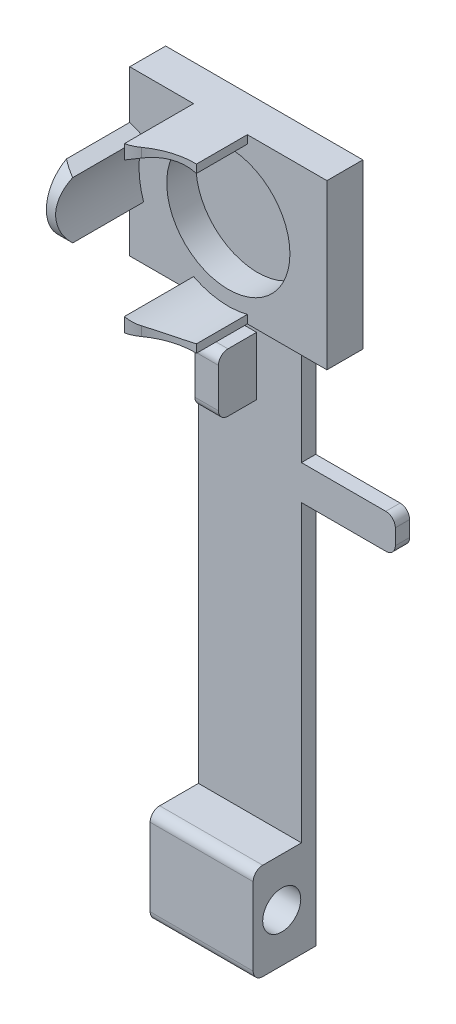
from build123d import *

# Parameters (mm, degrees)
EXTRUDE_4_DEPTH          = 3.01
SKETCH_3_W               = 41.43
SKETCH_3_H               = 34.43
EXTRUDE_5_DEPTH          = 4.54
SKETCH_4_R               = 12.94
CUT_EXTRUDE_1_DEPTH      = 6.14
EXTRUDE_7_DEPTH          = 4.94
EXTRUDE_9_DEPTH          = 21.64
SKETCH_8_R               = 4
CUT_EXTRUDE_2_DEPTH      = 138.779016272
EXTRUDE_10_DEPTH         = 14.55
CUT_EXTRUDE_7_REACH      = 154.706
CUT_EXTRUDE_7_END_RADIUS = 16
EXTRUDE_11_DEPTH         = 17.51
CUT_EXTRUDE_8_REACH      = 144.669
CUT_EXTRUDE_8_END_RADIUS = 18.768238988


with BuildPart() as part:
    # 草图1 → 凸台-拉伸4 (new body)
    with BuildSketch(Plane.XY):
        with BuildLine():
            Line((10.82, -17.215), (10.82, -41.305))
            Line((10.82, -41.305), (28.54, -41.305))
            ThreePointArc((28.54, -41.305), (29.954213562, -41.890786438), (30.54, -43.305))
            Line((30.54, -43.305), (30.54, -46.575))
            ThreePointArc((30.54, -46.575), (29.954213562, -47.989213562), (28.54, -48.575))
            Line((28.54, -48.575), (10.82, -48.575))
            Line((10.82, -48.575), (10.82, -130.765))
            Line((10.82, -130.765), (-10.82, -130.765))
            Line((-10.82, -130.765), (-10.82, -17.215))
            Line((-10.82, -17.215), (-20.715, -17.215))
            Line((-20.715, -17.215), (-20.715, 17.215))
            Line((-20.715, 17.215), (20.715, 17.215))
            Line((20.715, 17.215), (20.715, -17.215))
            Line((20.715, -17.215), (10.82, -17.215))
        make_face()
    extrude(amount=EXTRUDE_4_DEPTH)

    # 草图3 → 凸台-拉伸5 (add)
    with BuildSketch(Plane.XY.offset(3.01)):
        Rectangle(SKETCH_3_W, SKETCH_3_H)
    extrude(amount=EXTRUDE_5_DEPTH)

    # 草图4 → 切除-拉伸1 (cut)
    with BuildSketch(Plane.XY.offset(7.55)):
        Circle(SKETCH_4_R)
    extrude(amount=-CUT_EXTRUDE_1_DEPTH, mode=Mode.SUBTRACT)

    # 草图6 → 凸台-拉伸7 (add)
    with BuildSketch(Plane.ZY.offset(3.55)):
        with BuildLine():
            Line((3.01, -22.315), (9.02, -22.315))
            ThreePointArc((9.02, -22.315), (10.434213562, -22.900786438), (11.02, -24.315))
            Line((11.02, -24.315), (11.02, -32.585))
            ThreePointArc((11.02, -32.585), (10.434213562, -33.999213562), (9.02, -34.585))
            Line((9.02, -34.585), (3.01, -34.585))
            Line((3.01, -34.585), (3.01, -22.315))
        make_face()
    extrude(amount=-EXTRUDE_7_DEPTH)

    # 草图7 → 凸台-拉伸9 (add)
    with BuildSketch(Plane.ZY.offset(10.82)):
        with BuildLine():
            Line((3.01, -130.765), (11.15, -130.765))
            ThreePointArc((11.15, -130.765), (12.564213562, -130.179213562), (13.15, -128.765))
            Line((13.15, -128.765), (13.15, -112.485))
            ThreePointArc((13.15, -112.485), (12.564213562, -111.070786438), (11.15, -110.485))
            Line((11.15, -110.485), (3.01, -110.485))
            Line((3.01, -110.485), (3.01, -130.765))
        make_face()
    extrude(amount=-EXTRUDE_9_DEPTH)

    # 草图8 → 切除-拉伸2 (cut, through all)
    with BuildSketch(Plane.ZY.offset(10.82)):
        with Locations((7.15, -120.625)):
            Circle(SKETCH_8_R)
    extrude(amount=-CUT_EXTRUDE_2_DEPTH, mode=Mode.SUBTRACT)

    # 草图9 → 凸台-拉伸10 (add)
    with BuildSketch(Plane.XY.offset(7.55)):
        with BuildLine():
            Line((3.994247308, 17.215), (-7.290402008, 17.215))
            Line((-7.290402008, 17.215), (-7.290402008, 14.242543262))
            ThreePointArc((-7.290402008, 14.242543262), (-1.762762206, 15.902599454), (3.994247308, 15.493417584))
            Line((3.994247308, 15.493417584), (3.994247308, 17.215))
        make_face()
    extrude_10 = extrude(amount=EXTRUDE_10_DEPTH)

    # 切除-拉伸7: up to this cylinder (the profile starts outside it)
    cut_extrude_7_end = Plane(origin=(0, 0, 20.532167), z_dir=(0, 0, -1)) * Cylinder(CUT_EXTRUDE_7_END_RADIUS, 342.412, mode=Mode.PRIVATE)
    # 草图10 → 切除-拉伸7 (cut, up to the surface)
    with BuildSketch(Plane(origin=(0, 17.215, 0), x_dir=(1, 0, 0), z_dir=(0, 1, 0)), mode=Mode.PRIVATE) as cut_extrude_7_sk1:
        with BuildLine():
            Line((3.994247308, -21.947856721), (3.994247308, -18.232150221))
            ThreePointArc((3.994247308, -18.232150221), (-0.624975177, -18.880311606), (-4.799480887, -20.961376627))
            ThreePointArc((-4.799480887, -20.961376627), (-5.989188818, -21.652656126), (-7.290402008, -22.1))
            Line((-7.290402008, -22.1), (3.994247308, -22.1))
            Line((3.994247308, -22.1), (3.994247308, -21.947856721))
        make_face()
    cut_extrude_7_tool1 = extrude(cut_extrude_7_sk1.sketch, amount=-CUT_EXTRUDE_7_REACH, mode=Mode.PRIVATE) - cut_extrude_7_end
    cut_extrude_7 = cut_extrude_7_tool1.solids().sort_by_distance((-0.002076, 17.215, 20.532167))[0]
    add(cut_extrude_7, mode=Mode.SUBTRACT)

    # 镜向1: 凸台-拉伸10, 切除-拉伸7 across plane
    add(extrude_10.mirror(Plane(origin=(0, 0, 0), x_dir=(0, 0, 1), z_dir=(0, -1, 0))))
    add(cut_extrude_7.mirror(Plane(origin=(0, 0, 0), x_dir=(0, 0, 1), z_dir=(0, -1, 0))), mode=Mode.SUBTRACT)

    # 草图12 → 凸台-拉伸11 (add)
    with BuildSketch(Plane.XY.offset(7.55)):
        with BuildLine():
            Line((-17.802400725, 5.943174502), (-20.715, 7.09508926))
            Line((-20.715, 7.09508926), (-20.715, -7.09508926))
            Line((-20.715, -7.09508926), (-17.802400725, -5.943174502))
            ThreePointArc((-17.802400725, -5.943174502), (-18.768238988, 0), (-17.802400725, 5.943174502))
        make_face()
    extrude(amount=EXTRUDE_11_DEPTH)

    # 切除-拉伸8: up to this cylinder (the profile starts outside it)
    cut_extrude_8_end = Plane(origin=(0, 0, 23.877666), z_dir=(0, 0, -1)) * Cylinder(CUT_EXTRUDE_8_END_RADIUS, 327.874477976, mode=Mode.PRIVATE)
    # 草图13 → 切除-拉伸8 (cut, up to the surface)
    with BuildSketch(Plane.ZY.offset(20.715), mode=Mode.PRIVATE) as cut_extrude_8_sk1:
        with BuildLine():
            ThreePointArc((25.06, 0), (23.920244617, -4.131873769), (20.823346631, -7.09508926))
            Line((20.823346631, -7.09508926), (25.06, -7.09508926))
            Line((25.06, -7.09508926), (25.06, 0))
        make_face()
    cut_extrude_8_tool1 = extrude(cut_extrude_8_sk1.sketch, amount=-CUT_EXTRUDE_8_REACH, mode=Mode.PRIVATE) - cut_extrude_8_end
    add(cut_extrude_8_tool1.solids().sort_by_distance((-20.715, -5.42758, 23.877666))[0], mode=Mode.SUBTRACT)
    # 草图13 → 切除-拉伸8 (cut, up to the surface)
    with BuildSketch(Plane.ZY.offset(20.715), mode=Mode.PRIVATE) as cut_extrude_8_sk2:
        with BuildLine():
            ThreePointArc((20.823346631, 7.09508926), (23.920244617, 4.131873769), (25.06, 0))
            Line((25.06, 0), (25.06, 7.09508926))
            Line((25.06, 7.09508926), (20.823346631, 7.09508926))
        make_face()
    cut_extrude_8_tool2 = extrude(cut_extrude_8_sk2.sketch, amount=-CUT_EXTRUDE_8_REACH, mode=Mode.PRIVATE) - cut_extrude_8_end
    add(cut_extrude_8_tool2.solids().sort_by_distance((-20.715, 5.42758, 23.877666))[0], mode=Mode.SUBTRACT)


solid = part.part
